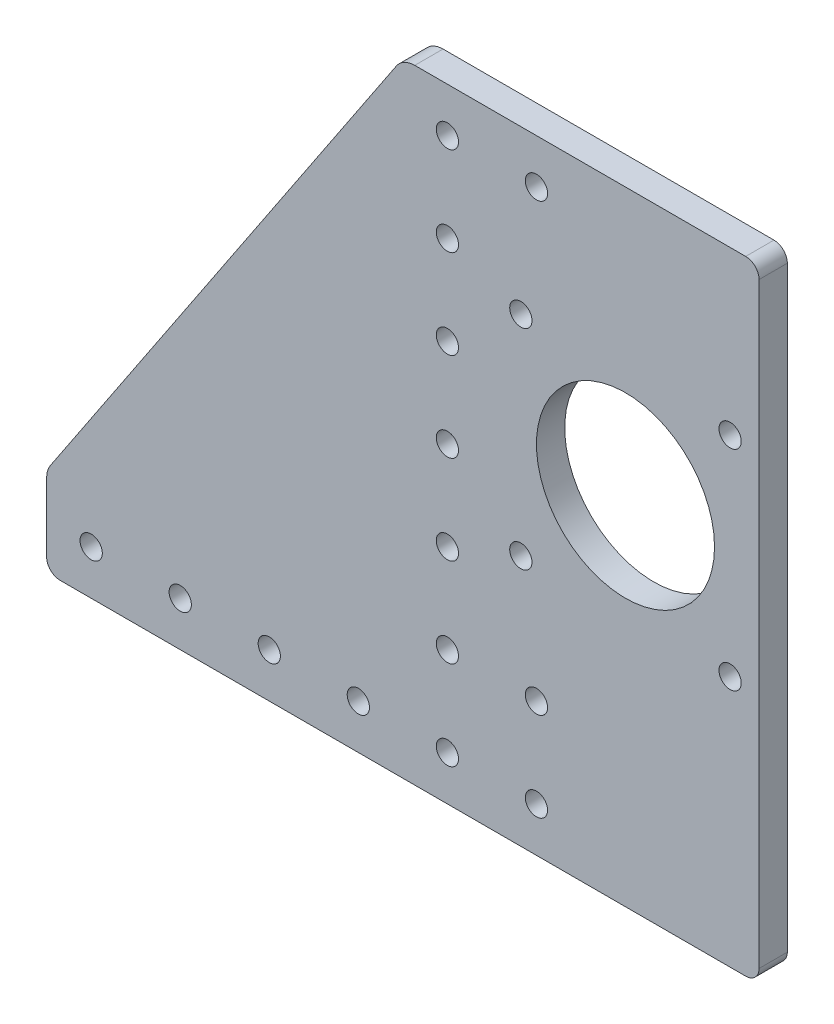
from build123d import *

# Parameters (mm, degrees)
SKETCH1_R           = 2.5
SKETCH1_R_2         = 20
BOSS_EXTRUDE1_DEPTH = 6.35
FILLET1_R           = 5
FILLET2_R           = 3


with BuildPart() as part:
    # Sketch1 → Boss-Extrude1 (new body)
    with BuildSketch(Plane.XY):
        Polygon((20, 61.824817518), (-60, 61.824817518), (-140, -58.175182482), (-140, -78.175182482), (20, -78.175182482), align=None)
        with Locations((-50, -48.175182482)):
            Circle(SKETCH1_R, mode=Mode.SUBTRACT)
        with Locations((-50, -28.175182482)):
            Circle(SKETCH1_R, mode=Mode.SUBTRACT)
        with Locations((-50, -8.175182482)):
            Circle(SKETCH1_R, mode=Mode.SUBTRACT)
        with Locations((-50, 11.824817518)):
            Circle(SKETCH1_R, mode=Mode.SUBTRACT)
        with Locations((-50, 31.824817518)):
            Circle(SKETCH1_R, mode=Mode.SUBTRACT)
        with Locations((-50, 51.824817518)):
            Circle(SKETCH1_R, mode=Mode.SUBTRACT)
        with Locations((-30, -48.175182482)):
            Circle(SKETCH1_R, mode=Mode.SUBTRACT)
        with Locations((-30, 51.824817518)):
            Circle(SKETCH1_R, mode=Mode.SUBTRACT)
        with Locations((-10, 1.824817518)):
            Circle(SKETCH1_R_2, mode=Mode.SUBTRACT)
        with Locations((-30, -68.175182482)):
            Circle(SKETCH1_R, mode=Mode.SUBTRACT)
        with Locations((-50, -68.175182482)):
            Circle(SKETCH1_R, mode=Mode.SUBTRACT)
        with Locations((-70, -68.175182482)):
            Circle(SKETCH1_R, mode=Mode.SUBTRACT)
        with Locations((-90, -68.175182482)):
            Circle(SKETCH1_R, mode=Mode.SUBTRACT)
        with Locations((-110, -68.175182482)):
            Circle(SKETCH1_R, mode=Mode.SUBTRACT)
        with Locations((-130, -68.175182482)):
            Circle(SKETCH1_R, mode=Mode.SUBTRACT)
        with Locations((-33.5, 25.324817518)):
            Circle(SKETCH1_R, mode=Mode.SUBTRACT)
        with Locations((13.5, 25.324817518)):
            Circle(SKETCH1_R, mode=Mode.SUBTRACT)
        with Locations((13.5, -21.675182482)):
            Circle(SKETCH1_R, mode=Mode.SUBTRACT)
        with Locations((-33.5, -21.675182482)):
            Circle(SKETCH1_R, mode=Mode.SUBTRACT)
    extrude(amount=BOSS_EXTRUDE1_DEPTH)

    # Fillet1
    fillet1_edges = [part.edges().sort_by_distance(p)[0] for p in [
        (-140, -58.175182482, 3.175),
        (-60, 61.824817518, 3.175),
    ]]
    fillet(fillet1_edges, radius=FILLET1_R)

    # Fillet2
    fillet2_edges = [part.edges().sort_by_distance(p)[0] for p in [
        (20, -78.175182482, 3.175),
        (-140, -78.175182482, 3.175),
        (20, 61.824817518, 3.175),
    ]]
    fillet(fillet2_edges, radius=FILLET2_R)


solid = part.part
